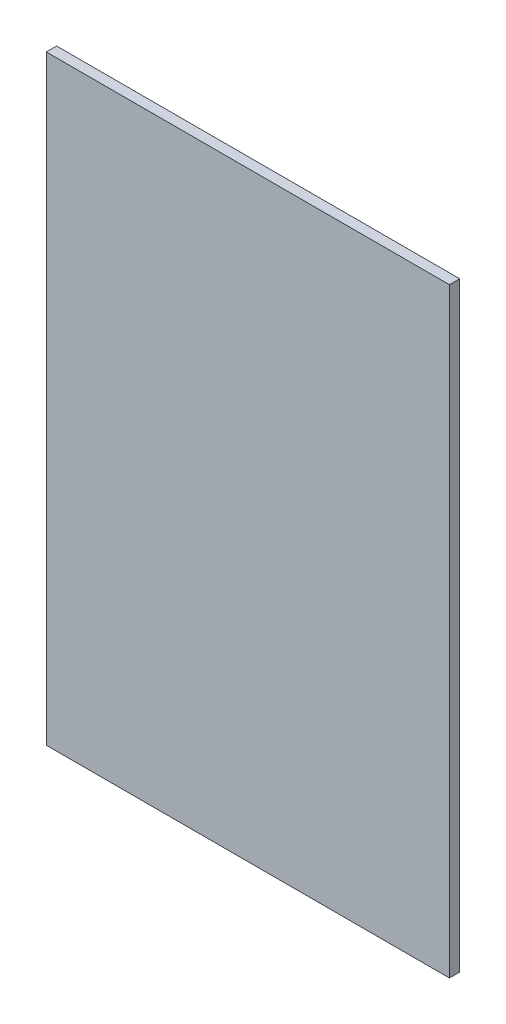
from build123d import *

# Parameters (mm, degrees)
SKETCH1_W           = 470
SKETCH1_H           = 700
BOSS_EXTRUDE1_DEPTH = 12


with BuildPart() as part:
    # Sketch1 → Boss-Extrude1 (new body)
    with BuildSketch(Plane.XY):
        Rectangle(SKETCH1_W, SKETCH1_H)
    extrude(amount=BOSS_EXTRUDE1_DEPTH)


solid = part.part
